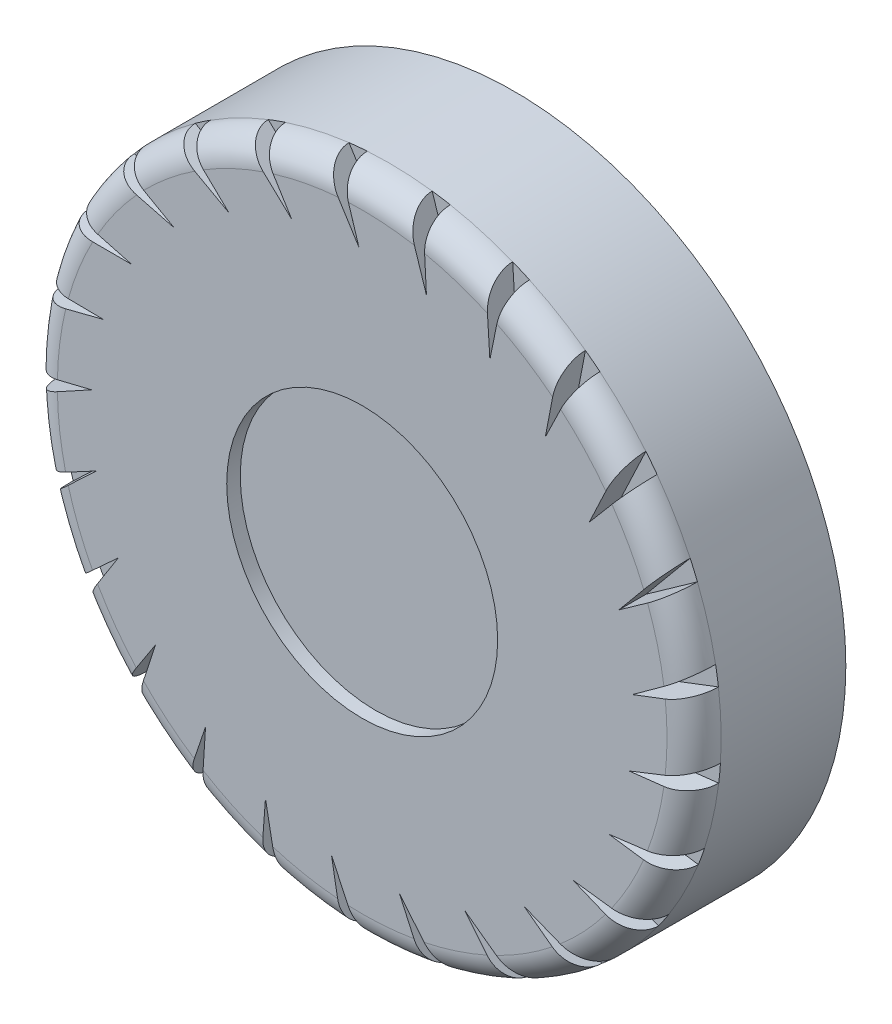
from build123d import *

# Parameters (mm, degrees)
SKETCH1_R           = 2.45
BOSS_EXTRUDE1_DEPTH = 1.12
FILLET1_R           = 0.2
SKETCH2_R           = 0.51
CUT_EXTRUDE2_DEPTH  = 0.03
CUT_EXTRUDE4_DEPTH  = 0.2
CIRPATTERN1_COUNT   = 25
SKETCH5_R           = 1
CUT_EXTRUDE5_DEPTH  = 0.1


with BuildPart() as part:
    # Sketch1 → Boss-Extrude1 (new body)
    with BuildSketch(Plane.XY):
        with Locations((-0.937077773, 0.507261108)):
            Circle(SKETCH1_R)
    extrude(amount=BOSS_EXTRUDE1_DEPTH)

    # Fillet1
    fillet1_edges = [part.edges().sort_by_distance(p)[0] for p in [
        (-3.387077773, 0.507261108, 1.12),
    ]]
    fillet(fillet1_edges, radius=FILLET1_R)

    # Sketch2 → Cut-Extrude2 (cut)
    with BuildSketch(Plane(origin=(0, 0, 0), x_dir=(-1, 0, 0), z_dir=(0, 0, -1))):
        with Locations((0.937077773, 0.507261108)):
            Circle(SKETCH2_R)
    extrude(amount=-CUT_EXTRUDE2_DEPTH, mode=Mode.SUBTRACT)

    # Sketch4 → Cut-Extrude4 (cut)
    with BuildSketch(Plane.XY.offset(1.12)):
        Polygon((-1.947426765, 4.065419102), (-1.447426765, 4.065419102), (-0.961080334, 2.507261108), align=None)
    cut_extrude4 = extrude(amount=-CUT_EXTRUDE4_DEPTH, mode=Mode.SUBTRACT)

    # CirPattern1: Cut-Extrude4 ×25 about axis
    cirpattern1_axis = Axis((-0.937077773, 0.507261108, 0), (0, 0, 1))
    for i in range(1, CIRPATTERN1_COUNT):
        add(cut_extrude4.rotate(cirpattern1_axis, i * 360 / CIRPATTERN1_COUNT), mode=Mode.SUBTRACT)

    # Sketch5 → Cut-Extrude5 (cut)
    with BuildSketch(Plane.XY.offset(1.12)):
        with Locations((-0.937077773, 0.507261108)):
            Circle(SKETCH5_R)
    extrude(amount=-CUT_EXTRUDE5_DEPTH, mode=Mode.SUBTRACT)


solid = part.part
